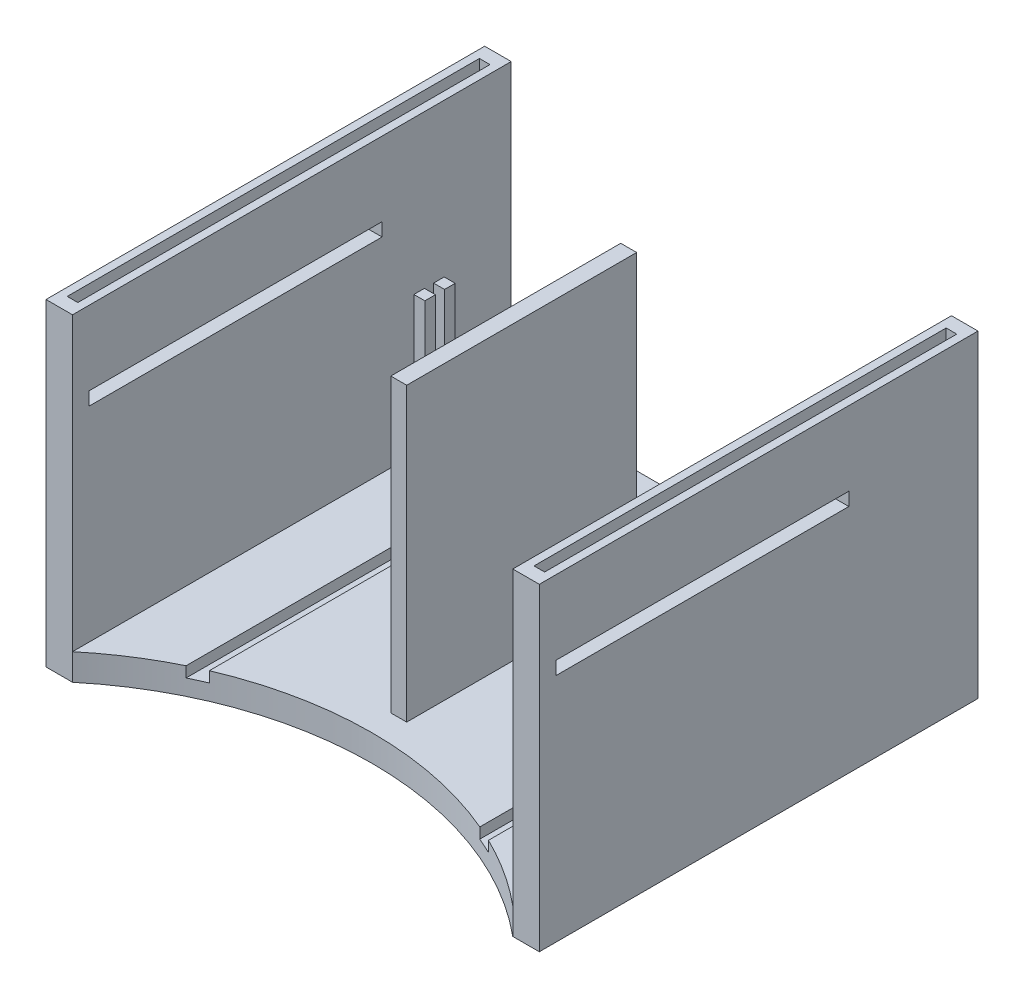
from build123d import *

# Parameters (mm, degrees)
EXTRUDE_THIN2_DEPTH     = 165.4
SKETCH11_W              = 166
SKETCH11_H              = 4
BOSS_EXTRUDE3_DEPTH     = 2.6416
CUT_EXTRUDE6_DEPTH      = 270.69086006
CUT_EXTRUDE6_DEPTH_BACK = 270.69086006
SKETCH13_W              = 110.495011338
SKETCH13_H              = 5
CUT_EXTRUDE7_DEPTH      = 273.127102656
SKETCH19_W              = 4
SKETCH19_H              = 155.4
CUT_EXTRUDE9_DEPTH      = 10
SKETCH20_W              = 4
SKETCH20_H              = 155.4
CUT_EXTRUDE10_DEPTH     = 10
SKETCH21_W              = 6
SKETCH21_H              = 86.697
BOSS_EXTRUDE4_DEPTH     = 110
CUT_EXTRUDE11_DEPTH     = 4
SKETCH23_W              = 166
SKETCH23_H              = 4
BOSS_EXTRUDE5_DEPTH     = 2.6416
SKETCH24_W              = 4.14
SKETCH24_H              = 4
BOSS_EXTRUDE6_DEPTH     = 49.64
SKETCH25_W              = 4.14
SKETCH25_H              = 4
BOSS_EXTRUDE7_DEPTH     = 49.64
SKETCH26_W              = 4.14
SKETCH26_H              = 4
BOSS_EXTRUDE8_DEPTH     = 49.64
SKETCH27_W              = 4.14
SKETCH27_H              = 4
BOSS_EXTRUDE9_DEPTH     = 49.64


with BuildPart() as part:
    # Sketch2 → Extrude-Thin2 (new body)
    with BuildSketch(Plane.XY):
        Polygon((0, 120), (0, 0), (186, 0), (186, 120), (176, 120), (176, 10), (10, 10), (10, 120), align=None)
    extrude(amount=EXTRUDE_THIN2_DEPTH)

    # Sketch11 → Boss-Extrude3 (add)
    with BuildSketch(Plane(origin=(0, 10, 0), x_dir=(1, 0, 0), z_dir=(0, 1, 0))):
        with Locations((93, -34.703)):
            Rectangle(SKETCH11_W, SKETCH11_H)
    extrude(amount=BOSS_EXTRUDE3_DEPTH)

    # Sketch13 → Cut-Extrude6 (cut, two sides: drawn at the far end of the back side and taken through both)
    with BuildSketch(Plane(origin=(10, 0, 0), x_dir=(0, 0, -1), z_dir=(1, 0, 0)).offset(-CUT_EXTRUDE6_DEPTH_BACK)):
        with Locations((-103.947505669, 89.551599899)):
            Rectangle(SKETCH13_W, SKETCH13_H)
    extrude(amount=CUT_EXTRUDE6_DEPTH + CUT_EXTRUDE6_DEPTH_BACK, mode=Mode.SUBTRACT)

    # Sketch14 → Cut-Extrude7 (cut, through all)
    with BuildSketch(Plane(origin=(0, 10, 0), x_dir=(1, 0, 0), z_dir=(0, 1, 0))):
        with BuildLine():
            Line((176, -165.4), (10, -165.4))
            ThreePointArc((10, -165.4), (93, -135.4), (176, -165.4))
        make_face()
    extrude(amount=-CUT_EXTRUDE7_DEPTH, mode=Mode.SUBTRACT)

    # Sketch19 → Cut-Extrude9 (cut)
    with BuildSketch(Plane(origin=(0, 120, 0), x_dir=(1, 0, 0), z_dir=(0, 1, 0))):
        with Locations((5, -82.7)):
            Rectangle(SKETCH19_W, SKETCH19_H)
    extrude(amount=-CUT_EXTRUDE9_DEPTH, mode=Mode.SUBTRACT)

    # Sketch20 → Cut-Extrude10 (cut)
    with BuildSketch(Plane(origin=(0, 120, 0), x_dir=(1, 0, 0), z_dir=(0, 1, 0))):
        with Locations((181, -82.7)):
            Rectangle(SKETCH20_W, SKETCH20_H)
    extrude(amount=-CUT_EXTRUDE10_DEPTH, mode=Mode.SUBTRACT)

    # Sketch21 → Boss-Extrude4 (add, through all)
    with BuildSketch(Plane(origin=(0, 10, 0), x_dir=(1, 0, 0), z_dir=(0, 1, 0))):
        with Locations((93, -82.0515)):
            Rectangle(SKETCH21_W, SKETCH21_H)
    extrude(amount=BOSS_EXTRUDE4_DEPTH)

    # Sketch22 → Cut-Extrude11 (cut)
    with BuildSketch(Plane(origin=(0, 10, 0), x_dir=(1, 0, 0), z_dir=(0, 1, 0))):
        Polygon((36, -48.703), (36, -148.583194008), (42, -145.837577441), (42, -48.703), align=None)
        Polygon((144, -145.837577441), (150, -148.583194008), (150, -48.703), (144, -48.703), align=None)
    extrude(amount=-CUT_EXTRUDE11_DEPTH, mode=Mode.SUBTRACT)

    # Sketch23 → Boss-Extrude5 (add)
    with BuildSketch(Plane(origin=(0, 10, 0), x_dir=(1, 0, 0), z_dir=(0, 1, 0))):
        with Locations((93, -27.263)):
            Rectangle(SKETCH23_W, SKETCH23_H)
    extrude(amount=BOSS_EXTRUDE5_DEPTH)

    # Sketch24 → Boss-Extrude6 (add)
    with BuildSketch(Plane(origin=(0, 12.6416, 0), x_dir=(1, 0, 0), z_dir=(0, 1, 0))):
        with Locations((12.07, -27.263)):
            Rectangle(SKETCH24_W, SKETCH24_H)
    extrude(amount=BOSS_EXTRUDE6_DEPTH)

    # Sketch25 → Boss-Extrude7 (add)
    with BuildSketch(Plane(origin=(0, 12.6416, 0), x_dir=(1, 0, 0), z_dir=(0, 1, 0))):
        with Locations((173.93, -27.263)):
            Rectangle(SKETCH25_W, SKETCH25_H)
    extrude(amount=BOSS_EXTRUDE7_DEPTH)

    # Sketch26 → Boss-Extrude8 (add)
    with BuildSketch(Plane(origin=(0, 12.6416, 0), x_dir=(1, 0, 0), z_dir=(0, 1, 0))):
        with Locations((12.07, -34.703)):
            Rectangle(SKETCH26_W, SKETCH26_H)
    extrude(amount=BOSS_EXTRUDE8_DEPTH)

    # Sketch27 → Boss-Extrude9 (add)
    with BuildSketch(Plane(origin=(0, 12.6416, 0), x_dir=(1, 0, 0), z_dir=(0, 1, 0))):
        with Locations((173.93, -34.703)):
            Rectangle(SKETCH27_W, SKETCH27_H)
    extrude(amount=BOSS_EXTRUDE9_DEPTH)


solid = part.part
